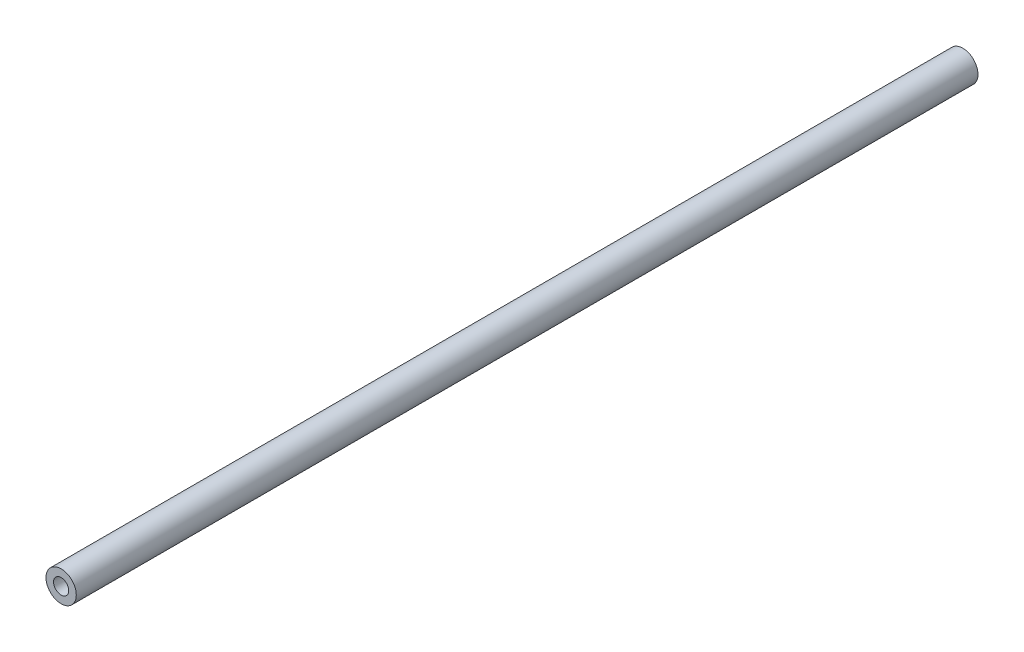
from build123d import *

# Parameters (mm, degrees)
SKETCH1_R           = 2
BOSS_EXTRUDE1_DEPTH = 119
SKETCH2_R           = 1
CUT_EXTRUDE1_DEPTH  = 119


with BuildPart() as part:
    # Sketch1 → Boss-Extrude1 (new body)
    with BuildSketch(Plane.XY):
        Circle(SKETCH1_R)
    extrude(amount=BOSS_EXTRUDE1_DEPTH)

    # Sketch2 → Cut-Extrude1 (cut)
    with BuildSketch(Plane(origin=(0, 0, 0), x_dir=(-1, 0, 0), z_dir=(0, 0, -1))):
        Circle(SKETCH2_R)
    extrude(amount=-CUT_EXTRUDE1_DEPTH, mode=Mode.SUBTRACT)


solid = part.part
